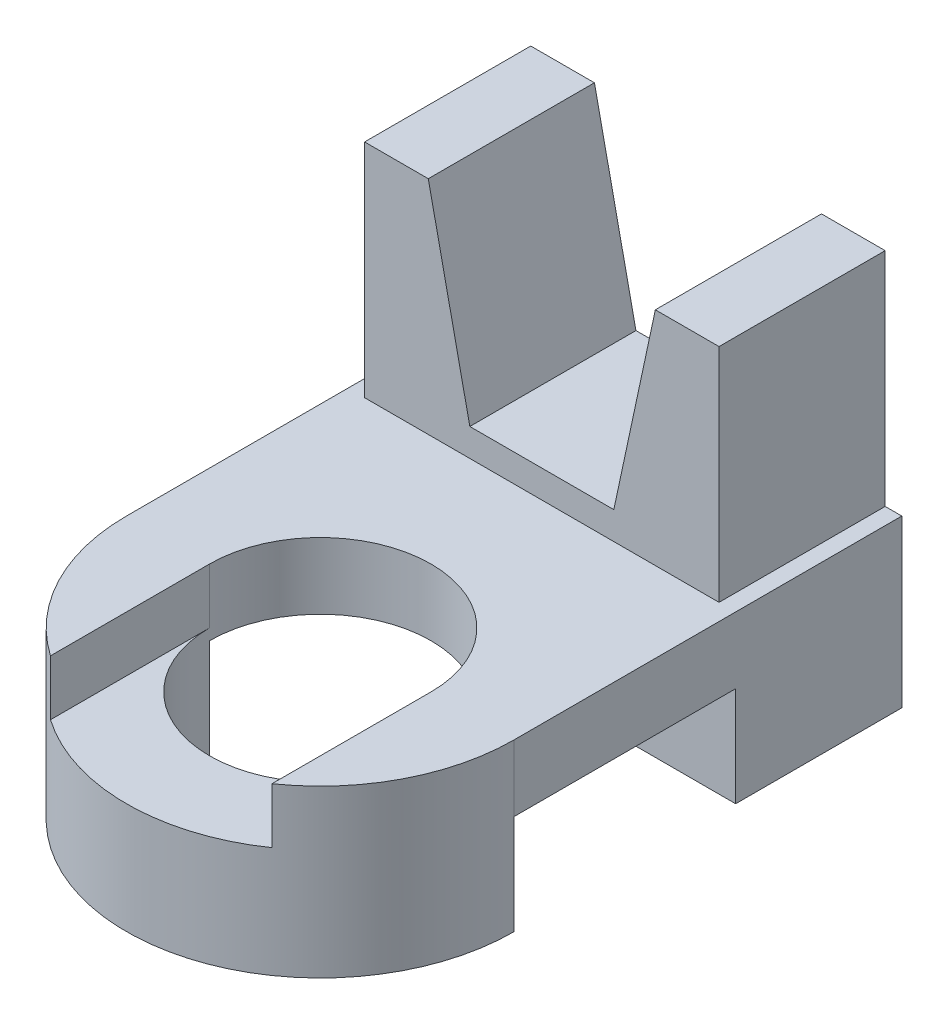
from build123d import *

# Parameters (mm, degrees)
SKETCH1_R           = 20
SKETCH1_W           = 70
SKETCH1_H           = 30
BOSS_EXTRUDE1_DEPTH = 30
SKETCH2_W           = 40
SKETCH2_H           = 18
CUT_EXTRUDE1_DEPTH  = 70
CUT_EXTRUDE2_START  = -10
CUT_EXTRUDE2_DEPTH  = 10
SKETCH4_W           = 64
SKETCH4_H           = 30
BOSS_EXTRUDE2_DEPTH = 40
CUT_EXTRUDE3_DEPTH  = 109.397416943


with BuildPart() as part:
    # Sketch1 → Boss-Extrude1 (new body)
    # profile 1 of 2: a face of its own
    with BuildSketch(Plane(origin=(0, 0, 0), x_dir=(1, 0, 0), z_dir=(0, 1, 0))):
        with BuildLine():
            Line((-35, 5), (-35, -35))
            ThreePointArc((-35, -35), (0, -70), (35, -35))
            Line((35, -35), (35, 5))
            Line((35, 5), (-35, 5))
        make_face()
        with Locations(Location((0, -35, 0), (0, 0, 270))):
            Circle(SKETCH1_R, mode=Mode.SUBTRACT)
    # profile 2 of 2: a face of its own
    with BuildSketch(Plane(origin=(0, 0, 0), x_dir=(1, 0, 0), z_dir=(0, 1, 0))):
        with Locations((0, 20)):
            Rectangle(SKETCH1_W, SKETCH1_H)
    extrude(amount=BOSS_EXTRUDE1_DEPTH)

    # Sketch2 → Cut-Extrude1 (cut)
    with BuildSketch(Plane(origin=(35, 0, 0), x_dir=(0, 0, -1), z_dir=(1, 0, 0))):
        with Locations((-15, 9)):
            Rectangle(SKETCH2_W, SKETCH2_H)
    extrude(amount=-CUT_EXTRUDE1_DEPTH, mode=Mode.SUBTRACT)

    # Sketch3 → Cut-Extrude2 (cut)
    with BuildSketch(Plane(origin=(0, 30, 0), x_dir=(1, 0, 0), z_dir=(0, 1, 0)).offset(CUT_EXTRUDE2_START)):
        with BuildLine():
            Line((20, -35), (20, -91.691085181))
            Line((20, -91.691085181), (-20, -91.691085181))
            Line((-20, -91.691085181), (-20, -35))
            ThreePointArc((-20, -35), (0, -15), (20, -35))
        make_face()
    extrude(amount=CUT_EXTRUDE2_DEPTH, mode=Mode.SUBTRACT)

    # Sketch4 → Boss-Extrude2 (add)
    with BuildSketch(Plane(origin=(0, 30, 0), x_dir=(1, 0, 0), z_dir=(0, 1, 0))):
        with Locations((0, 20)):
            Rectangle(SKETCH4_W, SKETCH4_H)
    extrude(amount=BOSS_EXTRUDE2_DEPTH)

    # Sketch5 → Cut-Extrude3 (cut, through all)
    with BuildSketch(Plane.XY.offset(-5)):
        Polygon((-20.5, 70), (20.5, 70), (13, 35), (-13, 35), align=None)
    extrude(amount=-CUT_EXTRUDE3_DEPTH, mode=Mode.SUBTRACT)


solid = part.part
